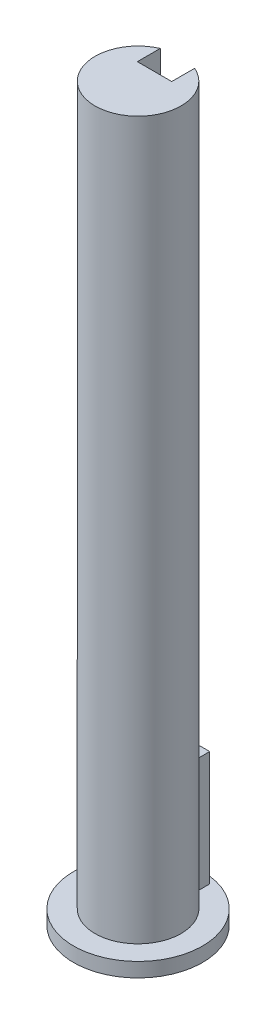
from build123d import *

# Parameters (mm, degrees)
EXTRUDE_2_DEPTH     = 50
EXTRUDE_3_DEPTH     = 8
CUT_EXTRUDE_1_DEPTH = 26
SKETCH_3_R          = 4.5
EXTRUDE_4_DEPTH     = 1


with BuildPart() as part:
    # 스케치1 → 보스-돌출2 (new body)
    with BuildSketch(Plane(origin=(0, 0, 0), x_dir=(1, 0, 0), z_dir=(0, 1, 0))):
        with BuildLine():
            ThreePointArc((1, 2.828427125), (0, 3), (-1, 2.828427125))
            ThreePointArc((-1, 2.828427125), (-1.732050808, -2.449489743), (3, 0))
            ThreePointArc((3, 0), (2.449489743, 1.732050808), (1, 2.828427125))
        make_face()
    extrude(amount=EXTRUDE_2_DEPTH)

    # 스케치1<3> → 보스-돌출3 (add)
    with BuildSketch(Plane(origin=(0, 0, 0), x_dir=(1, 0, 0), z_dir=(0, 1, 0))):
        with BuildLine():
            Line((-1, 4), (-1, 2.828427125))
            ThreePointArc((-1, 2.828427125), (0, 3), (1, 2.828427125))
            Line((1, 2.828427125), (1, 4))
            Line((1, 4), (-1, 4))
        make_face()
    extrude(amount=EXTRUDE_3_DEPTH)

    # 스케치2 → 컷-돌출1 (cut)
    with BuildSketch(Plane(origin=(0, 50, 0), x_dir=(1, 0, 0), z_dir=(0, 1, 0))):
        Polygon((-1.2, 1.149545417), (1.2, 1.149545417), (1.2, 2.749545417), (0, 4.828006386), (-1.2, 2.749545417), align=None)
    extrude(amount=-CUT_EXTRUDE_1_DEPTH, mode=Mode.SUBTRACT)

    # 스케치3 → 보스-돌출4 (add)
    with BuildSketch(Plane.XZ):
        Circle(SKETCH_3_R)
    extrude(amount=EXTRUDE_4_DEPTH)


solid = part.part
